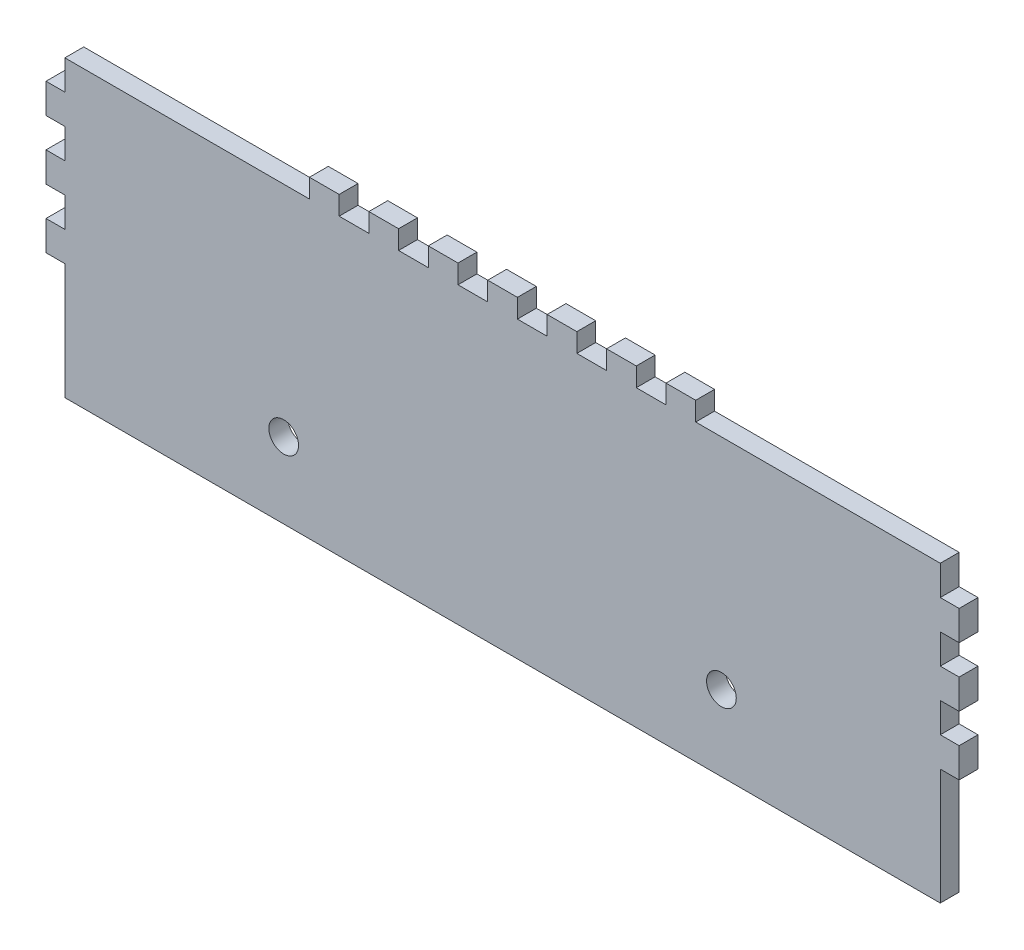
from build123d import *

# Parameters (mm, degrees)
SKETCH1_R           = 2.5
BOSS_EXTRUDE1_DEPTH = 3.175


with BuildPart() as part:
    # Sketch1 → Boss-Extrude1 (new body)
    with BuildSketch(Plane.XY):
        Polygon((-147.32, 0), (-106.16, 0), (-106.16, 3.175), (-101.16, 3.175), (-101.16, 0), (-96.16, 0), (-96.16, 3.175), (-91.16, 3.175), (-91.16, 0), (-86.16, 0), (-86.16, 3.175), (-81.16, 3.175), (-81.16, 0), (-76.16, 0), (-76.16, 3.175), (-71.16, 3.175), (-71.16, 0), (-66.16, 0), (-66.16, 3.175), (-61.16, 3.175), (-61.16, 0), (-56.16, 0), (-56.16, 3.175), (-51.16, 3.175), (-51.16, 0), (-46.16, 0), (-46.16, 3.175), (-41.16, 3.175), (-41.16, 0), (0, 0), (0, -5), (3.175, -5), (3.175, -10), (0, -10), (0, -15), (3.175, -15), (3.175, -20), (0, -20), (0, -25), (3.175, -25), (3.175, -30), (0, -30), (0, -49.53), (-147.32, -49.53), (-147.32, -30), (-150.495, -30), (-150.495, -25), (-147.32, -25), (-147.32, -20), (-150.495, -20), (-150.495, -15), (-147.32, -15), (-147.32, -10), (-150.495, -10), (-150.495, -5), (-147.32, -5), align=None)
        with Locations((-110.49, -36.83)):
            Circle(SKETCH1_R, mode=Mode.SUBTRACT)
        with Locations((-36.83, -36.83)):
            Circle(SKETCH1_R, mode=Mode.SUBTRACT)
    extrude(amount=BOSS_EXTRUDE1_DEPTH)


solid = part.part
